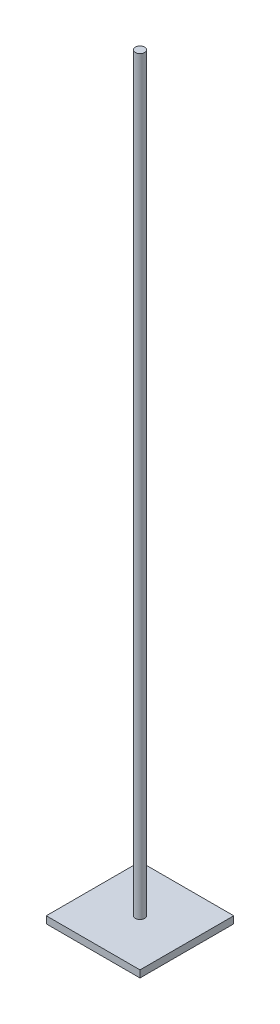
from build123d import *

# Parameters (mm, degrees)
SKETCH1_W           = 200
SKETCH1_H           = 200
BOSS_EXTRUDE1_DEPTH = 15
SKETCH2_R           = 10
BOSS_EXTRUDE2_DEPTH = 1600


with BuildPart() as part:
    # Sketch1 → Boss-Extrude1 (new body)
    with BuildSketch(Plane(origin=(0, 0, 0), x_dir=(1, 0, 0), z_dir=(0, 1, 0))):
        Rectangle(SKETCH1_W, SKETCH1_H)
    extrude(amount=BOSS_EXTRUDE1_DEPTH)

    # Sketch2 → Boss-Extrude2 (add)
    with BuildSketch(Plane(origin=(0, 15, 0), x_dir=(1, 0, 0), z_dir=(0, 1, 0))):
        with Locations(Location((0, 0, 0), (0, 0, 90))):
            Circle(SKETCH2_R)
    extrude(amount=BOSS_EXTRUDE2_DEPTH)


solid = part.part
